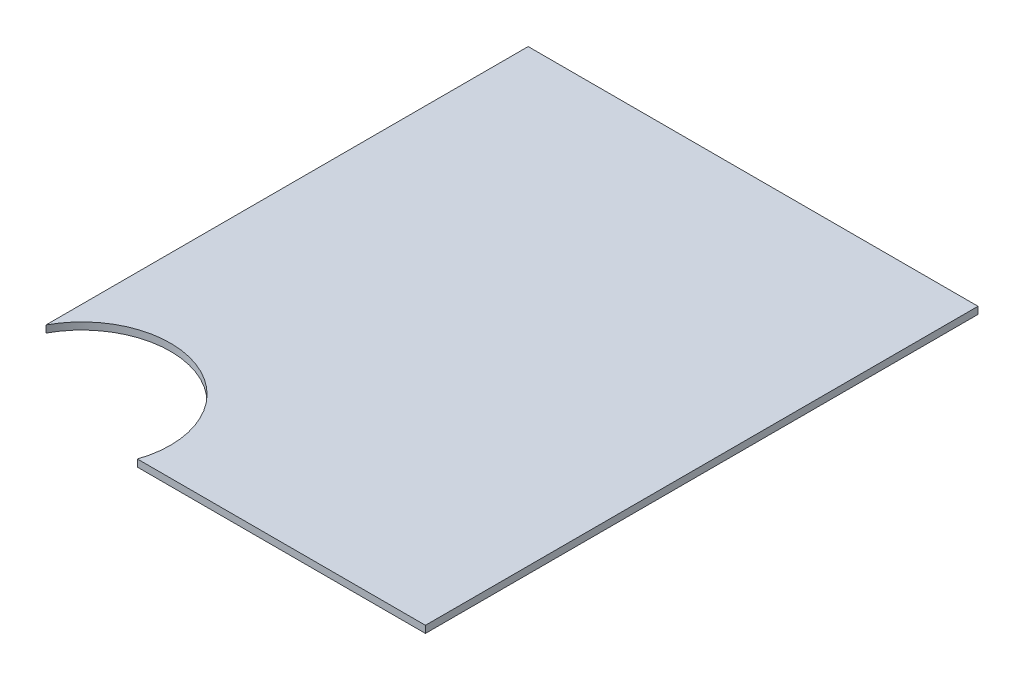
from build123d import *

# Parameters (mm, degrees)
SKETCH1_W           = 127
SKETCH1_H           = 156
BOSS_EXTRUDE1_DEPTH = 2
SKETCH2_R           = 25
CUT_EXTRUDE1_DEPTH  = 2


with BuildPart() as part:
    # Sketch1 → Boss-Extrude1 (new body)
    with BuildSketch(Plane(origin=(0, 0, 0), x_dir=(1, 0, 0), z_dir=(0, 1, 0))):
        Rectangle(SKETCH1_W, SKETCH1_H)
    extrude(amount=BOSS_EXTRUDE1_DEPTH)

    # Sketch2 → Cut-Extrude1 (cut)
    with BuildSketch(Plane(origin=(0, 2, 0), x_dir=(1, 0, 0), z_dir=(0, 1, 0))):
        with Locations((-41.5, -70)):
            Circle(SKETCH2_R)
    extrude(amount=-CUT_EXTRUDE1_DEPTH, mode=Mode.SUBTRACT)


solid = part.part
